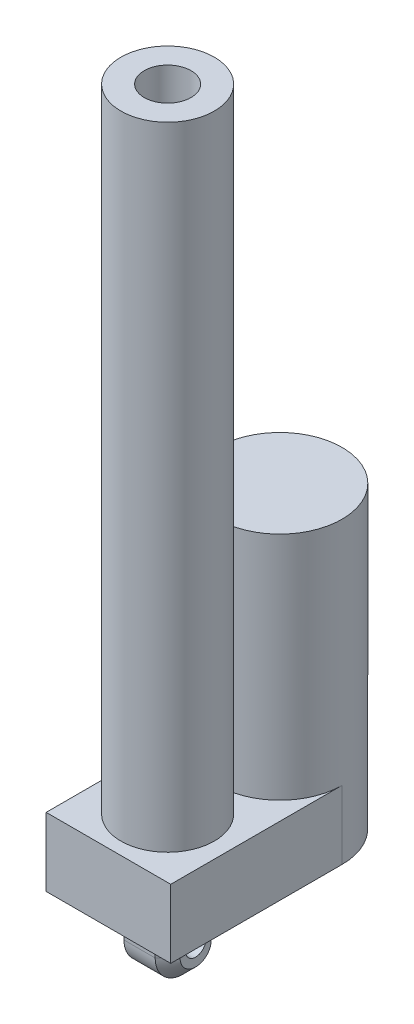
from build123d import *

# Parameters (mm, degrees)
EXTRUDE_1_DEPTH          = 22
SKETCH_2_R               = 20
EXTRUDE_2_DEPTH          = 74
SKETCH_3_R               = 15
EXTRUDE_3_DEPTH          = 203
SKETCH_4_R               = 7.5
CUT_EXTRUDE_1_DEPTH      = 150
SKETCH_5_W               = 18
SKETCH_5_H               = 18
EXTRUDE_4_DEPTH          = 20
CUT_EXTRUDE_2_DEPTH      = 232.780607472
CUT_EXTRUDE_2_DEPTH_BACK = 232.780607472
CUT_EXTRUDE_3_DEPTH      = 232.780607472
CUT_EXTRUDE_3_DEPTH_BACK = 232.780607472
CHAMFER_1_SIZE           = 4
CHAMFER_2_SIZE           = 4
CUT_EXTRUDE_4_DEPTH      = 232.780607472
CUT_EXTRUDE_4_DEPTH_BACK = 232.780607472
SKETCH_8_R               = 3.25


with BuildPart() as part:
    # 草图1 → 凸台-拉伸1 (new body)
    with BuildSketch(Plane(origin=(0, 0, 0), x_dir=(1, 0, 0), z_dir=(0, 1, 0))):
        with BuildLine():
            Line((-20, -27.5), (20, -27.5))
            Line((20, -27.5), (20, 27.5))
            ThreePointArc((20, 27.5), (0, 47.5), (-20, 27.5))
            Line((-20, 27.5), (-20, -27.5))
        make_face()
    extrude(amount=EXTRUDE_1_DEPTH)

    # 草图2 → 凸台-拉伸2 (add)
    with BuildSketch(Plane(origin=(0, 22, 0), x_dir=(1, 0, 0), z_dir=(0, 1, 0))):
        with Locations(Location((0, 27.5, 0), (0, 0, 180))):
            Circle(SKETCH_2_R)
    extrude(amount=EXTRUDE_2_DEPTH)

    # 草图3 → 凸台-拉伸3 (add)
    with BuildSketch(Plane(origin=(0, 22, 0), x_dir=(1, 0, 0), z_dir=(0, 1, 0))):
        with Locations(Location((0, -8.5, 0), (0, 0, 90))):
            Circle(SKETCH_3_R)
    extrude(amount=EXTRUDE_3_DEPTH)

    # 草图4 → 切除-拉伸1 (cut)
    with BuildSketch(Plane(origin=(0, 225, 0), x_dir=(1, 0, 0), z_dir=(0, 1, 0))):
        with Locations(Location((0, -8.5, 0), (0, 0, 270))):
            Circle(SKETCH_4_R)
    extrude(amount=-CUT_EXTRUDE_1_DEPTH, mode=Mode.SUBTRACT)

    # 草图5 → 凸台-拉伸4 (add)
    with BuildSketch(Plane.XZ):
        with Locations((0, 8.5)):
            Rectangle(SKETCH_5_W, SKETCH_5_H)
    extrude(amount=EXTRUDE_4_DEPTH)

    # 草图6 → 切除-拉伸2 (cut, two sides: drawn at the far end of the back side and taken through both)
    with BuildSketch(Plane.ZY.offset(9).offset(-CUT_EXTRUDE_2_DEPTH_BACK)):
        with BuildLine():
            Line((8.5, -20), (-0.5, -20))
            Line((-0.5, -20), (-0.5, -11))
            ThreePointArc((-0.5, -11), (2.136038969, -17.363961031), (8.5, -20))
        make_face()
    extrude(amount=CUT_EXTRUDE_2_DEPTH + CUT_EXTRUDE_2_DEPTH_BACK, mode=Mode.SUBTRACT)

    # 草图7 → 切除-拉伸3 (cut, two sides: drawn at the far end of the back side and taken through both)
    with BuildSketch(Plane.ZY.offset(9).offset(-CUT_EXTRUDE_3_DEPTH_BACK)):
        with BuildLine():
            Line((8.5, -20), (17.5, -20))
            Line((17.5, -20), (17.5, -11))
            ThreePointArc((17.5, -11), (14.863961031, -17.363961031), (8.5, -20))
        make_face()
    extrude(amount=CUT_EXTRUDE_3_DEPTH + CUT_EXTRUDE_3_DEPTH_BACK, mode=Mode.SUBTRACT)

    # 倒角1
    chamfer_1_edges = [part.edges().sort_by_distance(p)[0] for p in [
        (-9, -5.5, -0.5),
        (-9, -20, 8.5),
        (-9, -5.5, 17.5),
    ]]
    chamfer(chamfer_1_edges, length=CHAMFER_1_SIZE)

    # 倒角2
    chamfer_2_edges = [part.edges().sort_by_distance(p)[0] for p in [
        (9, -5.5, -0.5),
        (9, -20, 8.5),
        (9, -5.5, 17.5),
    ]]
    chamfer(chamfer_2_edges, length=CHAMFER_2_SIZE)

    # 草图8 → 切除-拉伸4 (cut, two sides: drawn at the far end of the back side and taken through both)
    with BuildSketch(Plane(origin=(9, 0, 0), x_dir=(0, 0, -1), z_dir=(1, 0, 0)).offset(-CUT_EXTRUDE_4_DEPTH_BACK)):
        with Locations((-8.5, -10)):
            Circle(SKETCH_8_R)
    extrude(amount=CUT_EXTRUDE_4_DEPTH + CUT_EXTRUDE_4_DEPTH_BACK, mode=Mode.SUBTRACT)


solid = part.part
